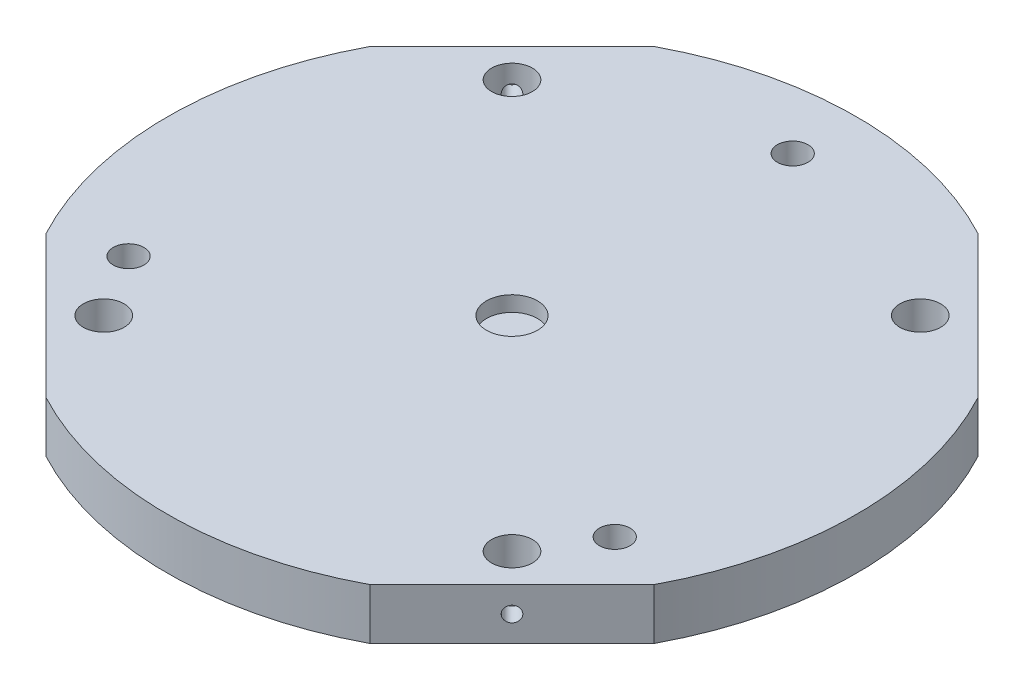
from build123d import *

# Parameters (mm, degrees)
SKETCH1_R                  = 67.5
BOSS_EXTRUDE1_DEPTH        = 10
F_6_0MM_DOWEL_HOLE1_D      = 6
CUT_EXTRUDE1_DEPTH         = 96.981769102
CUT_EXTRUDE1_DEPTH_BACK    = 96.981769102
SKETCH4_R                  = 4
CUT_EXTRUDE_THIN1_DEPTH    = 96.981769102
F_3_0MM_DOWEL_HOLE1_REACH  = 162.34
F_3_0MM_DOWEL_HOLE1_BORE_R = 1.5
CIRPATTERN1_COUNT          = 4
CUT_EXTRUDE2_DEPTH         = 96.981769113
CUT_EXTRUDE2_DEPTH_BACK    = 3
SKETCH8_R                  = 5


with BuildPart() as part:
    # Sketch1 → Boss-Extrude1 (new body)
    with BuildSketch(Plane(origin=(0, 0, 0), x_dir=(1, 0, 0), z_dir=(0, 1, 0))):
        with Locations(Location((0, 0, 0), (0, 0, 270))):
            Circle(SKETCH1_R)
    extrude(amount=BOSS_EXTRUDE1_DEPTH)

    # Ø6.0mm Dowel Hole1 (through all)
    with Locations(Plane(origin=(0, 10, 0), x_dir=(1, 0, 0), z_dir=(0, 1, 0))):
        with Locations((0, 55), (47.631397208, -27.5), (-47.631397208, -27.5)):
            Hole(F_6_0MM_DOWEL_HOLE1_D / 2)

    # Sketch4 → Cut-Extrude1 (cut, two sides: drawn at the far end of the back side and taken through both)
    with BuildSketch(Plane(origin=(0, 10, 0), x_dir=(1, 0, 0), z_dir=(0, 1, 0)).offset(-CUT_EXTRUDE1_DEPTH_BACK)):
        with Locations(Location((-40, 40, 0), (0, 0, 270))):
            Circle(SKETCH4_R)
        with Locations(Location((40, 40, 0), (0, 0, 270))):
            Circle(SKETCH4_R)
        with Locations(Location((40, -40, 0), (0, 0, 270))):
            Circle(SKETCH4_R)
        with Locations(Location((-40, -40, 0), (0, 0, 270))):
            Circle(SKETCH4_R)
    extrude(amount=CUT_EXTRUDE1_DEPTH + CUT_EXTRUDE1_DEPTH_BACK, mode=Mode.SUBTRACT)

    # Sketch5 → Cut-Extrude-Thin1 (cut, through all)
    with BuildSketch(Plane(origin=(0, 10, 0), x_dir=(1, 0, 0), z_dir=(0, 1, 0))):
        Polygon((-31.743671291, 59.570037208), (-59.570037208, 31.743671291), (-66.64110502, 38.814739103), (-38.814739103, 66.64110502), align=None)
        Polygon((59.570037208, 31.743671291), (31.743671291, 59.570037208), (38.814739103, 66.64110502), (66.64110502, 38.814739103), align=None)
        Polygon((31.743671291, -59.570037208), (59.570037208, -31.743671291), (66.64110502, -38.814739103), (38.814739103, -66.64110502), align=None)
        Polygon((-59.570037208, -31.743671291), (-31.743671291, -59.570037208), (-38.814739103, -66.64110502), (-66.64110502, -38.814739103), align=None)
    extrude(amount=-CUT_EXTRUDE_THIN1_DEPTH, mode=Mode.SUBTRACT)

    # Ø3.0mm Dowel Hole1 bore → Ø3.0mm Dowel Hole1 (cut, up to next)
    with BuildSketch(Plane(origin=(45.656854249, 0, 45.656854249), x_dir=(0.7071067811865479, 0, -0.7071067811865471), z_dir=(0.7071067811865471, 0, 0.7071067811865479)), mode=Mode.PRIVATE) as f_3_0mm_dowel_hole1_sk1:
        with Locations((0, 5)):
            Circle(F_3_0MM_DOWEL_HOLE1_BORE_R)
    f_3_0mm_dowel_hole1_tool1 = extrude(f_3_0mm_dowel_hole1_sk1.sketch, amount=-F_3_0MM_DOWEL_HOLE1_REACH, mode=Mode.PRIVATE) & part.part
    f_3_0mm_dowel_hole1 = f_3_0mm_dowel_hole1_tool1.solids().sort_by_distance((45.656854, 5, 45.656854))[0]
    add(f_3_0mm_dowel_hole1, mode=Mode.SUBTRACT)

    # CirPattern1: Ø3.0mm Dowel Hole1 ×4 about axis
    cirpattern1_axis = Axis((0, 10, 0), (0, -1, 0))
    for i in range(1, CIRPATTERN1_COUNT):
        add(f_3_0mm_dowel_hole1.rotate(cirpattern1_axis, i * 360 / CIRPATTERN1_COUNT), mode=Mode.SUBTRACT)

    # Sketch8 → Cut-Extrude2 (cut, two sides: drawn at the far end of the back side and taken through both)
    with BuildSketch(Plane(origin=(0, 10, 0), x_dir=(1, 0, 0), z_dir=(0, 1, 0)).offset(-CUT_EXTRUDE2_DEPTH_BACK)):
        with Locations(Location((0, 0, 0), (0, 0, 90))):
            Circle(SKETCH8_R)
    extrude(amount=CUT_EXTRUDE2_DEPTH + CUT_EXTRUDE2_DEPTH_BACK, mode=Mode.SUBTRACT)


solid = part.part
